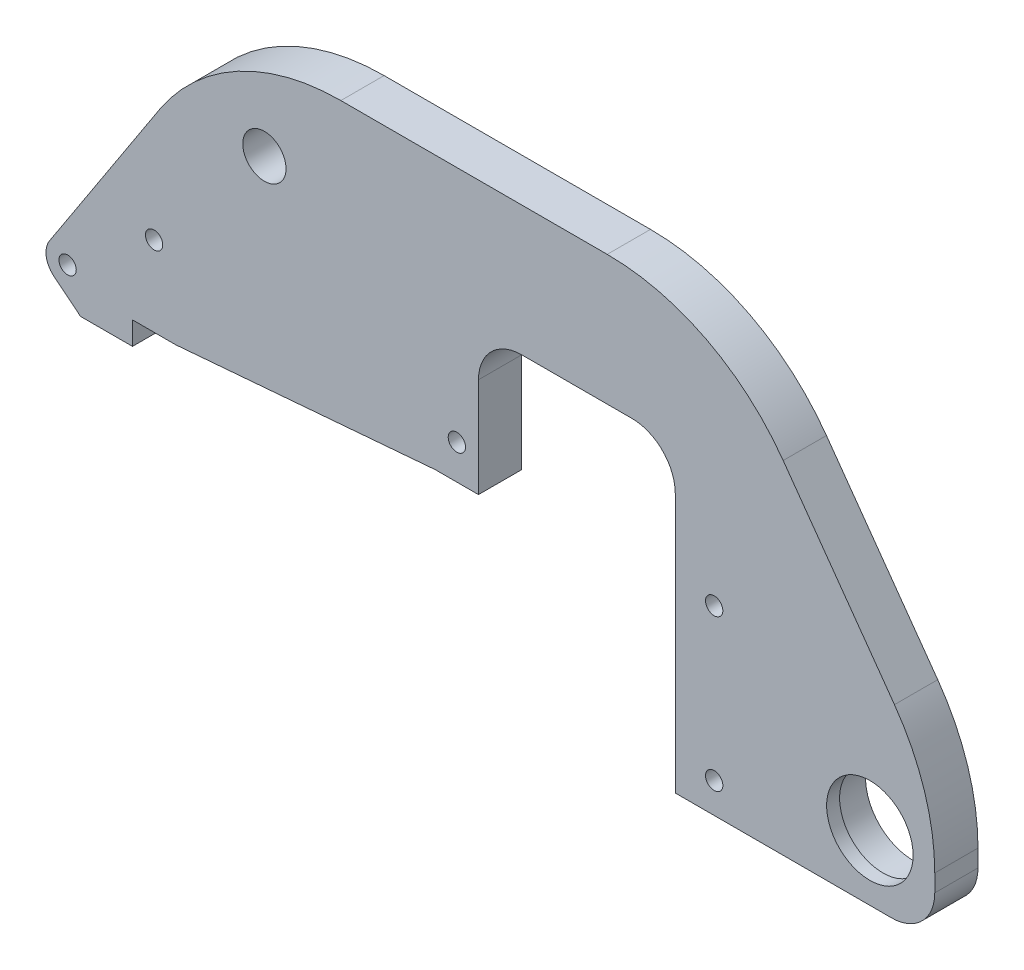
from build123d import *

# Parameters (mm, degrees)
SKETCH1_R               = 11
SKETCH1_R_2             = 2
SKETCH1_W               = 10
SKETCH1_H               = 16
BOSS_EXTRUDE1_DEPTH     = 10
FILLET1_R               = 10
FILLET2_R               = 50
FILLET3_R               = 5
BOSS_EXTRUDE2_START     = -3
SKETCH2_R               = 11
SKETCH2_R_2             = 10
BOSS_EXTRUDE2_DEPTH     = 3
CUT_EXTRUDE1_DEPTH      = 124.835576471
CUT_EXTRUDE1_DEPTH_BACK = 124.835576471
SKETCH3_R               = 5


with BuildPart() as part:
    # Sketch1 → Boss-Extrude1 (new body)
    # profile 1 of 2: a face of its own
    with BuildSketch(Plane.XY):
        Polygon((-75, -13), (-65, -13), (-5, -8), (-5, 8), (5, 8), (5, 25), (50.5, 25), (50.5, -45), (76.132488073, -45), (110.5, -45), (110.5, -15), (60.5, 55), (-53.909617462, 55), (-96.658561066, -10.557288279), (-87.02, -18.32), (-75, -18.32), align=None)
        with Locations((95.5, -30)):
            Circle(SKETCH1_R, mode=Mode.SUBTRACT)
        with Locations((59.5, -38)):
            Circle(SKETCH1_R_2, mode=Mode.SUBTRACT)
        with Locations((59.5, -3)):
            Circle(SKETCH1_R_2, mode=Mode.SUBTRACT)
        with Locations((-70, 5.5)):
            Circle(SKETCH1_R_2, mode=Mode.SUBTRACT)
        with Locations((-90, -9.5)):
            Circle(SKETCH1_R_2, mode=Mode.SUBTRACT)
    # profile 2 of 2: a face of its own
    with BuildSketch(Plane.XY):
        Rectangle(SKETCH1_W, SKETCH1_H)
        Circle(SKETCH1_R_2, mode=Mode.SUBTRACT)
    extrude(amount=BOSS_EXTRUDE1_DEPTH)

    # Fillet1
    fillet1_edges = [part.edges().sort_by_distance(p)[0] for p in [
        (110.5, -45, 5),
        (50.5, 25, 5),
        (5, 25, 5),
    ]]
    fillet(fillet1_edges, radius=FILLET1_R)

    # Fillet2
    fillet2_edges = [part.edges().sort_by_distance(p)[0] for p in [
        (-53.909617462, 55, 5),
        (60.5, 55, 5),
        (110.5, -15, 5),
    ]]
    fillet(fillet2_edges, radius=FILLET2_R)

    # Fillet3
    fillet3_edges = [part.edges().sort_by_distance(p)[0] for p in [
        (-96.658561066, -10.557288279, 5),
    ]]
    fillet(fillet3_edges, radius=FILLET3_R)

    # Sketch2 → Boss-Extrude2 (add)
    with BuildSketch(Plane.XY.offset(10).offset(BOSS_EXTRUDE2_START)):
        with Locations((95.5, -30)):
            Circle(SKETCH2_R)
        with Locations((95.5, -30)):
            Circle(SKETCH2_R_2, mode=Mode.SUBTRACT)
    extrude(amount=BOSS_EXTRUDE2_DEPTH)

    # Sketch3 → Cut-Extrude1 (cut, two sides: drawn at the far end of the back side and taken through both)
    with BuildSketch(Plane.XY.offset(10).offset(-CUT_EXTRUDE1_DEPTH_BACK)):
        with Locations((-44.5, 35)):
            Circle(SKETCH3_R)
    extrude(amount=CUT_EXTRUDE1_DEPTH + CUT_EXTRUDE1_DEPTH_BACK, mode=Mode.SUBTRACT)


solid = part.part
